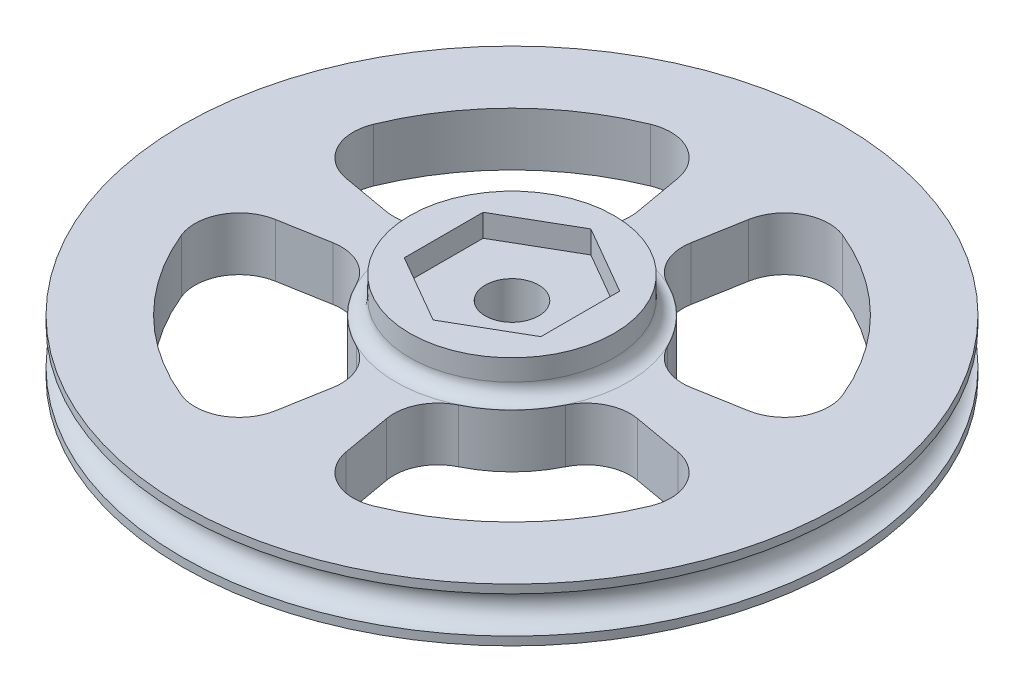
from build123d import *

# Parameters (mm, degrees)
CUT_EXTRUDE1_DEPTH  = 43.303774347
CIRPATTERN1_COUNT   = 4
SKETCH8_R           = 9.2075
BOSS_EXTRUDE1_DEPTH = 3.175
CUT_EXTRUDE2_DEPTH  = 2.032
SKETCH7_R           = 2.413
CUT_EXTRUDE3_DEPTH  = 43.782415184
FILLET1_R           = 1.27


with BuildPart() as part:
    # Sketch1 → Revolve1 (revolve)
    with BuildSketch(Plane(origin=(0, 0, 0), x_dir=(0, 0, -1), z_dir=(1, 0, 0))):
        with BuildLine():
            Line((0, -1.651), (0, 1.651))
            Line((0, 1.651), (0, 2.413))
            Line((0, 2.413), (-29.718, 2.413))
            Line((-29.718, 2.413), (-29.718, 1.651))
            ThreePointArc((-29.718, 1.651), (-28.067, 0), (-29.718, -1.651))
            Line((-29.718, -1.651), (-29.718, -2.413))
            Line((-29.718, -2.413), (0, -2.413))
            Line((0, -2.413), (0, -1.651))
        make_face()
    revolve(axis=Axis((0, -1.651, 0), (0, 1, 0)))

    # Sketch4 → Cut-Extrude1 (cut, through all)
    with BuildSketch(Plane(origin=(0, 2.413, 0), x_dir=(1, 0, 0), z_dir=(0, 1, 0))):
        with BuildLine():
            Line((-18.150933962, -3.200499383), (-13.725620051, -2.420197142))
            ThreePointArc((-13.725620051, -2.420197142), (-11.215481947, -2.795189817), (-9.436261178, -4.605103146))
            ThreePointArc((-9.436261178, -4.605103146), (-7.424621202, -7.424621202), (-4.605103146, -9.436261178))
            ThreePointArc((-4.605103146, -9.436261178), (-2.795189817, -11.215481947), (-2.420197142, -13.725620051))
            Line((-2.420197142, -13.725620051), (-3.200499383, -18.150933962))
            ThreePointArc((-3.200499383, -18.150933962), (-5.207970247, -20.958954952), (-8.653989227, -21.158640563))
            ThreePointArc((-8.653989227, -21.158640563), (-16.164461018, -16.164461018), (-21.158640563, -8.653989227))
            ThreePointArc((-21.158640563, -8.653989227), (-20.958954952, -5.207970247), (-18.150933962, -3.200499383))
        make_face()
    cut_extrude1 = extrude(amount=-CUT_EXTRUDE1_DEPTH, mode=Mode.SUBTRACT)

    # CirPattern1: Cut-Extrude1 ×4 about axis
    cirpattern1_axis = Axis((0, 2.413, 0), (0, -1, 0))
    for i in range(1, CIRPATTERN1_COUNT):
        add(cut_extrude1.rotate(cirpattern1_axis, i * 360 / CIRPATTERN1_COUNT), mode=Mode.SUBTRACT)

    # Sketch8 → Boss-Extrude1 (add)
    with BuildSketch(Plane(origin=(0, 2.413, 0), x_dir=(1, 0, 0), z_dir=(0, 1, 0))):
        Circle(SKETCH8_R)
    extrude(amount=BOSS_EXTRUDE1_DEPTH)

    # Sketch6 → Cut-Extrude2 (cut)
    with BuildSketch(Plane(origin=(0, 5.588, 0), x_dir=(1, 0, 0), z_dir=(0, 1, 0))):
        Polygon((0, 7.112377966), (-6.1595, 3.556188983), (-6.1595, -3.556188983), (0, -7.112377966), (6.1595, -3.556188983), (6.1595, 3.556188983), align=None)
    extrude(amount=-CUT_EXTRUDE2_DEPTH, mode=Mode.SUBTRACT)

    # Sketch7 → Cut-Extrude3 (cut, through all)
    with BuildSketch(Plane(origin=(0, 5.588, 0), x_dir=(1, 0, 0), z_dir=(0, 1, 0))):
        Circle(SKETCH7_R)
    extrude(amount=-CUT_EXTRUDE3_DEPTH, mode=Mode.SUBTRACT)

    # Fillet1
    fillet1_edges = [part.edges().sort_by_distance(p)[0] for p in [
        (-9.2075, 2.413, 0),
    ]]
    fillet(fillet1_edges, radius=FILLET1_R)


solid = part.part
